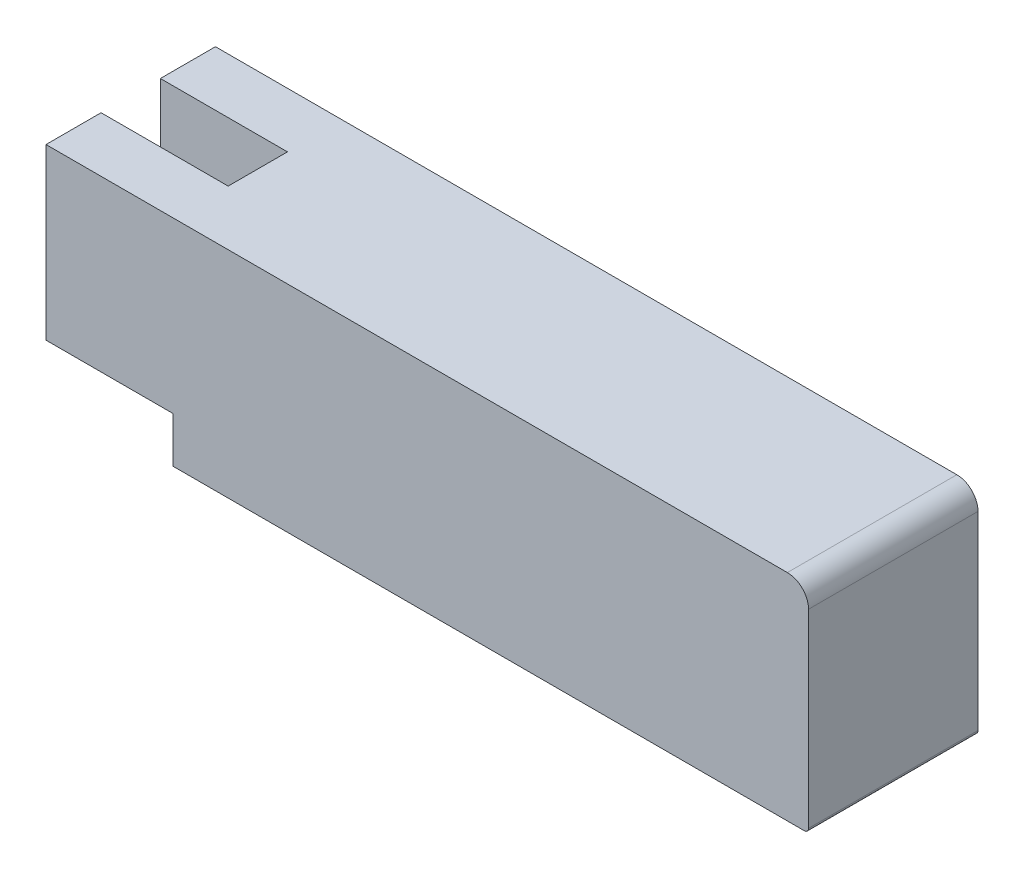
from build123d import *

# Parameters (mm, degrees)
EXTRUDE_1_DEPTH     = 20
SKETCH_2_W          = 30
SKETCH_2_H          = 40
CUT_EXTRUDE_1_DEPTH = 7
FILLET_1_R          = 5
FILLET_2_R          = 1


with BuildPart() as part:
    # 스케치1 → 보스-돌출1 (new, symmetric)
    with BuildSketch(Plane.XY):
        Polygon((0, -40), (30, -40), (30, -50.78), (180, -50.78), (180, 0), (0, 0), align=None)
    extrude(amount=EXTRUDE_1_DEPTH, both=True)

    # 스케치2 → 컷-돌출1 (cut, symmetric)
    with BuildSketch(Plane.XY):
        with Locations((15, -20)):
            Rectangle(SKETCH_2_W, SKETCH_2_H)
    extrude(amount=CUT_EXTRUDE_1_DEPTH, both=True, mode=Mode.SUBTRACT)

    # 필렛1
    fillet_1_edges = [part.edges().sort_by_distance(p)[0] for p in [
        (180, 0, 0),
    ]]
    fillet(fillet_1_edges, radius=FILLET_1_R)

    # 필렛2
    fillet_2_edges = [part.edges().sort_by_distance(p)[0] for p in [
        (180, -50.78, 0),
    ]]
    fillet(fillet_2_edges, radius=FILLET_2_R)


solid = part.part
